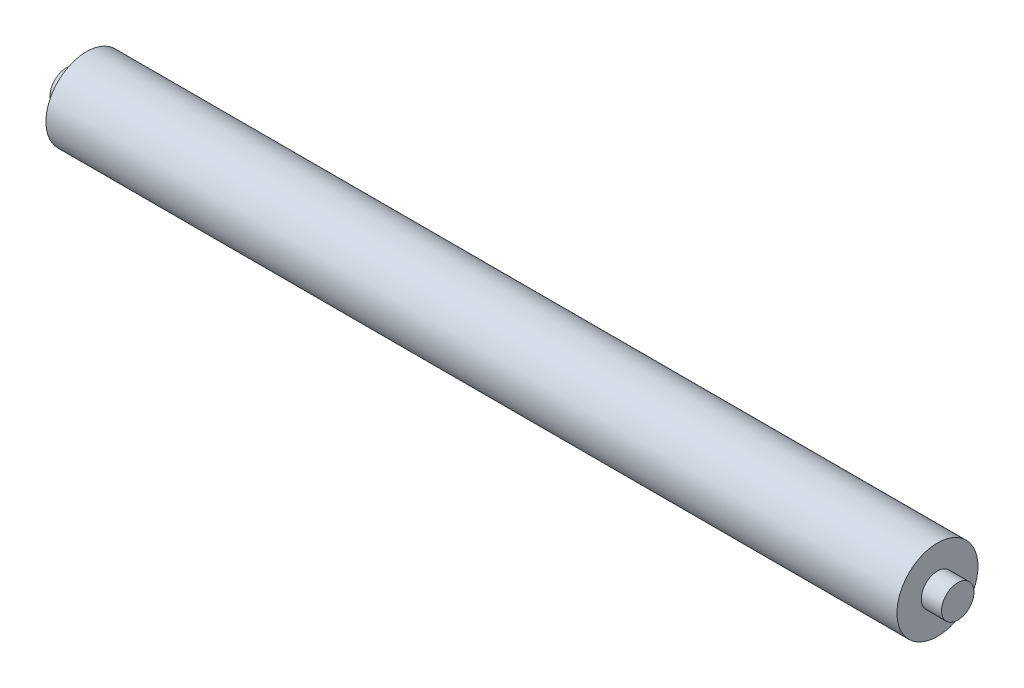
from build123d import *

# Parameters (mm, degrees)
CROQUIS1_R              = 5
SALIENTE_EXTRUIR1_DEPTH = 52.5
CROQUIS2_R              = 2
SALIENTE_EXTRUIR2_DEPTH = 55


with BuildPart() as part:
    # Croquis1 → Saliente-Extruir1 (new, symmetric)
    with BuildSketch(Plane(origin=(0, 0, 0), x_dir=(0, 0, -1), z_dir=(1, 0, 0))):
        Circle(CROQUIS1_R)
    extrude(amount=SALIENTE_EXTRUIR1_DEPTH, both=True)

    # Croquis2 → Saliente-Extruir2 (add, symmetric)
    with BuildSketch(Plane(origin=(0, 0, 0), x_dir=(0, 0, -1), z_dir=(1, 0, 0))):
        Circle(CROQUIS2_R)
    extrude(amount=SALIENTE_EXTRUIR2_DEPTH, both=True)


solid = part.part
